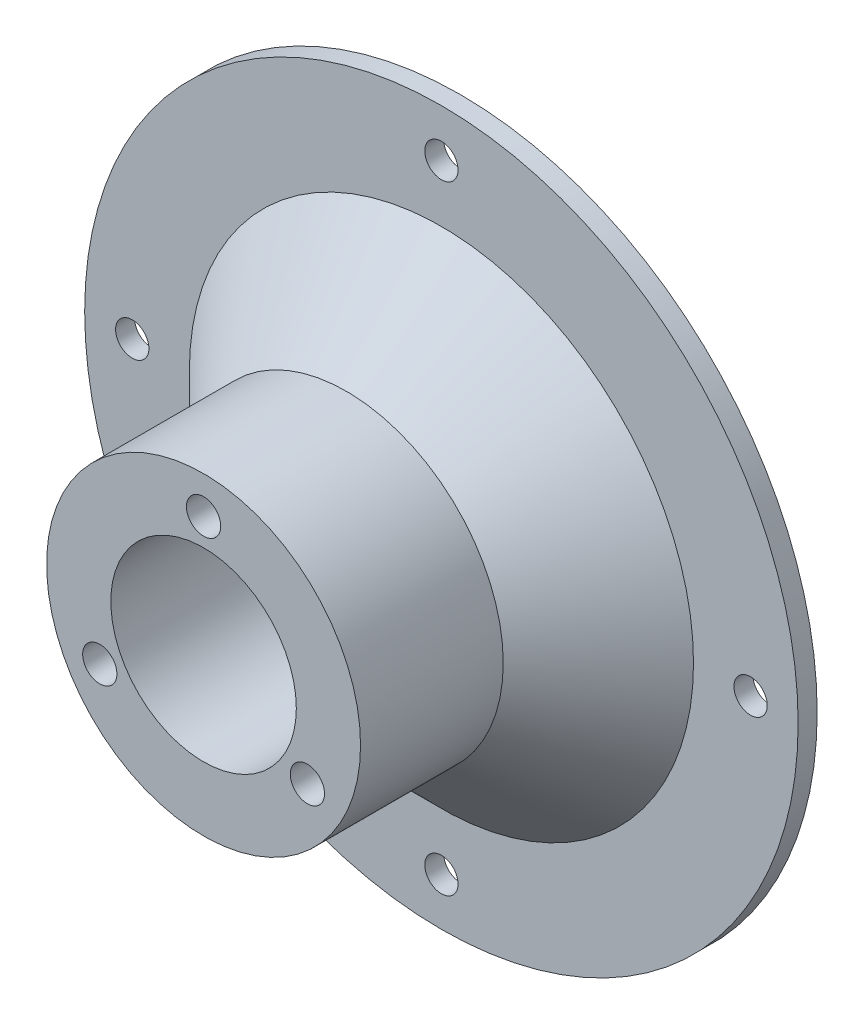
from build123d import *

# Parameters (mm, degrees)
SKETCH_1_R          = 37.5
EXTRUDE_1_DEPTH     = 2
SKETCH_2_R          = 1.75
CUT_EXTRUDE_1_DEPTH = 2
SKETCH_3_R          = 16.5
EXTRUDE_2_DEPTH     = 25
SKETCH_4_R          = 9.75
SKETCH_4_R_2        = 1.8
CUT_EXTRUDE_2_DEPTH = 27
CHAMFER_1_SIZE      = 10


with BuildPart() as part:
    # Эскиз1 → Бобышка-Вытянуть1 (new body)
    with BuildSketch(Plane.XY):
        Circle(SKETCH_1_R)
    extrude(amount=EXTRUDE_1_DEPTH)

    # Эскиз2 → Вырез-Вытянуть1 (cut)
    with BuildSketch(Plane.XY.offset(2)):
        with Locations((0, 32.5)):
            Circle(SKETCH_2_R)
        with Locations((32.5, 0)):
            Circle(SKETCH_2_R)
        with Locations((0, -32.5)):
            Circle(SKETCH_2_R)
        with Locations((-32.5, 0)):
            Circle(SKETCH_2_R)
    extrude(amount=-CUT_EXTRUDE_1_DEPTH, mode=Mode.SUBTRACT)

    # Эскиз3 → Бобышка-Вытянуть2 (add)
    with BuildSketch(Plane.XY.offset(2)):
        Circle(SKETCH_3_R)
    extrude(amount=EXTRUDE_2_DEPTH)

    # Эскиз4 → Вырез-Вытянуть2 (cut)
    with BuildSketch(Plane.XY.offset(27)):
        Circle(SKETCH_4_R)
        with Locations((0, 12.6)):
            Circle(SKETCH_4_R_2)
        with Locations((10.911920088, -6.3)):
            Circle(SKETCH_4_R_2)
        with Locations((-10.911920088, -6.3)):
            Circle(SKETCH_4_R_2)
    extrude(amount=-CUT_EXTRUDE_2_DEPTH, mode=Mode.SUBTRACT)

    # Фаска1
    chamfer_1_edges = [part.edges().sort_by_distance(p)[0] for p in [
        (-16.5, 0, 2),
    ]]
    chamfer(chamfer_1_edges, length=CHAMFER_1_SIZE)


solid = part.part
